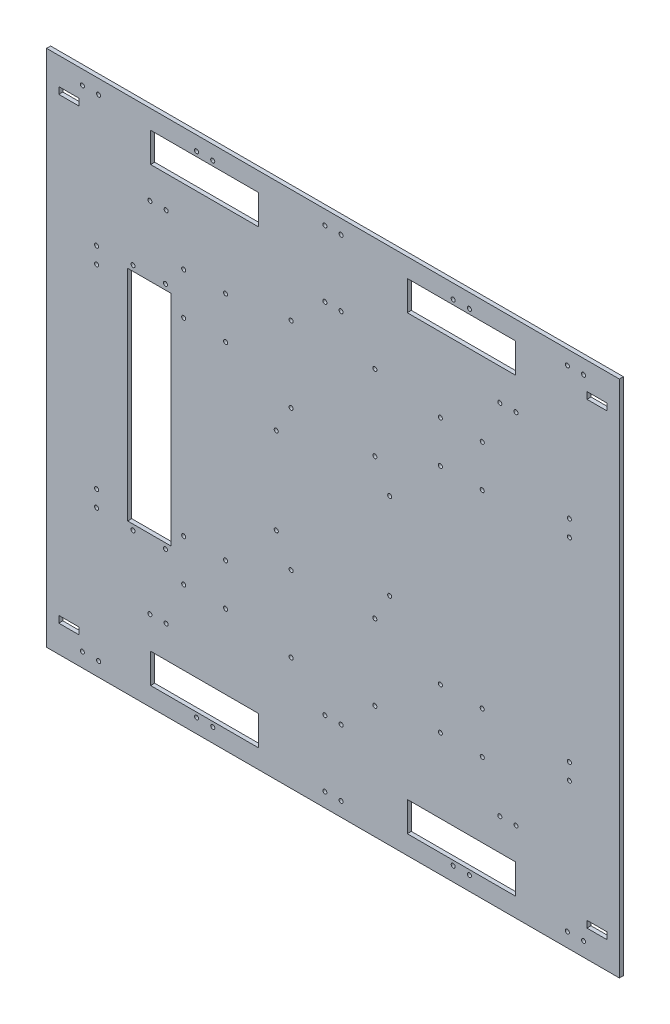
from build123d import *

# Parameters (mm, degrees)
SKETCH_1_W          = 424
SKETCH_1_H          = 384
SKETCH_1_W_2        = 80
SKETCH_1_H_2        = 22
EXTRUDE_1_DEPTH     = 3
SKETCH_2_R          = 1.5
SKETCH_2_W          = 32
SKETCH_2_H          = 162
CUT_EXTRUDE_1_DEPTH = 573.049823005
SKETCH_3_R          = 1.5
CUT_EXTRUDE_2_DEPTH = 573.049823005
SKETCH_4_R          = 1.5
CUT_EXTRUDE_3_DEPTH = 573.049823005
SKETCH_5_W          = 15
SKETCH_5_H          = 5
CUT_EXTRUDE_4_DEPTH = 573.049823005
SKETCH_6_R          = 1.5
CUT_EXTRUDE_5_DEPTH = 573.049823005


with BuildPart() as part:
    # 草图1 → 凸台-拉伸1 (new body)
    with BuildSketch(Plane.XY):
        with Locations((212, 192)):
            Rectangle(SKETCH_1_W, SKETCH_1_H)
        with Locations((307, 359)):
            Rectangle(SKETCH_1_W_2, SKETCH_1_H_2, mode=Mode.SUBTRACT)
        with Locations((117, 359)):
            Rectangle(SKETCH_1_W_2, SKETCH_1_H_2, mode=Mode.SUBTRACT)
        with Locations((307, 25)):
            Rectangle(SKETCH_1_W_2, SKETCH_1_H_2, mode=Mode.SUBTRACT)
        with Locations((117, 25)):
            Rectangle(SKETCH_1_W_2, SKETCH_1_H_2, mode=Mode.SUBTRACT)
    extrude(amount=EXTRUDE_1_DEPTH)

    # 草图2 → 切除-拉伸1 (cut, through all)
    with BuildSketch(Plane.XY.offset(3)):
        with Locations((64, 277)):
            Circle(SKETCH_2_R)
        with Locations((88, 277)):
            Circle(SKETCH_2_R)
        with Locations(Location((88, 107, 0), (0, 0, 180))):
            Circle(SKETCH_2_R)
        with Locations(Location((64, 107, 0), (0, 0, 180))):
            Circle(SKETCH_2_R)
        with Locations((76, 192)):
            Rectangle(SKETCH_2_W, SKETCH_2_H)
    extrude(amount=-CUT_EXTRUDE_1_DEPTH, mode=Mode.SUBTRACT)

    # 草图3 → 切除-拉伸2 (cut, through all)
    with BuildSketch(Plane.XY.offset(3)):
        with Locations((101.5, 293)):
            Circle(SKETCH_3_R)
        with Locations((132.5, 293)):
            Circle(SKETCH_3_R)
        with Locations((101.5, 262)):
            Circle(SKETCH_3_R)
        with Locations((132.5, 262)):
            Circle(SKETCH_3_R)
        with Locations(Location((322.5, 262, 0), (0, 0, 180))):
            Circle(SKETCH_3_R)
        with Locations(Location((291.5, 262, 0), (0, 0, 180))):
            Circle(SKETCH_3_R)
        with Locations(Location((291.5, 293, 0), (0, 0, 180))):
            Circle(SKETCH_3_R)
        with Locations(Location((322.5, 293, 0), (0, 0, 180))):
            Circle(SKETCH_3_R)
        with Locations((291.5, 122)):
            Circle(SKETCH_3_R)
        with Locations((322.5, 122)):
            Circle(SKETCH_3_R)
        with Locations((322.5, 91)):
            Circle(SKETCH_3_R)
        with Locations((291.5, 91)):
            Circle(SKETCH_3_R)
        with Locations(Location((101.5, 122, 0), (0, 0, 180))):
            Circle(SKETCH_3_R)
        with Locations(Location((132.5, 122, 0), (0, 0, 180))):
            Circle(SKETCH_3_R)
        with Locations(Location((132.5, 91, 0), (0, 0, 180))):
            Circle(SKETCH_3_R)
        with Locations(Location((101.5, 91, 0), (0, 0, 180))):
            Circle(SKETCH_3_R)
    extrude(amount=-CUT_EXTRUDE_2_DEPTH, mode=Mode.SUBTRACT)

    # 草图4 → 切除-拉伸3 (cut, through all)
    with BuildSketch(Plane.XY.offset(3)):
        with Locations((218, 10.5)):
            Circle(SKETCH_4_R)
        with Locations((301, 10.5)):
            Circle(SKETCH_4_R)
        with Locations((313, 10.5)):
            Circle(SKETCH_4_R)
        with Locations((385.5, 10.5)):
            Circle(SKETCH_4_R)
        with Locations((397.5, 10.5)):
            Circle(SKETCH_4_R)
        with Locations((218, 59.5)):
            Circle(SKETCH_4_R)
        with Locations((335.5, 59.5)):
            Circle(SKETCH_4_R)
        with Locations((347.5, 59.5)):
            Circle(SKETCH_4_R)
        with Locations((387, 108)):
            Circle(SKETCH_4_R)
        with Locations((387, 120)):
            Circle(SKETCH_4_R)
        with Locations(Location((387, 276, 0), (0, 0, 180))):
            Circle(SKETCH_4_R)
        with Locations(Location((387, 264, 0), (0, 0, 180))):
            Circle(SKETCH_4_R)
        with Locations(Location((301, 373.5, 0), (0, 0, 180))):
            Circle(SKETCH_4_R)
        with Locations(Location((313, 373.5, 0), (0, 0, 180))):
            Circle(SKETCH_4_R)
        with Locations(Location((397.5, 373.5, 0), (0, 0, 180))):
            Circle(SKETCH_4_R)
        with Locations(Location((385.5, 373.5, 0), (0, 0, 180))):
            Circle(SKETCH_4_R)
        with Locations(Location((347.5, 324.5, 0), (0, 0, 180))):
            Circle(SKETCH_4_R)
        with Locations(Location((335.5, 324.5, 0), (0, 0, 180))):
            Circle(SKETCH_4_R)
        with Locations(Location((218, 373.5, 0), (0, 0, 180))):
            Circle(SKETCH_4_R)
        with Locations(Location((206, 59.5, 0), (0, 0, 180))):
            Circle(SKETCH_4_R)
        with Locations(Location((206, 10.5, 0), (0, 0, 180))):
            Circle(SKETCH_4_R)
        with Locations(Location((111, 10.5, 0), (0, 0, 180))):
            Circle(SKETCH_4_R)
        with Locations(Location((123, 10.5, 0), (0, 0, 180))):
            Circle(SKETCH_4_R)
        with Locations(Location((26.5, 10.5, 0), (0, 0, 180))):
            Circle(SKETCH_4_R)
        with Locations(Location((38.5, 10.5, 0), (0, 0, 180))):
            Circle(SKETCH_4_R)
        with Locations(Location((76.5, 59.5, 0), (0, 0, 180))):
            Circle(SKETCH_4_R)
        with Locations(Location((88.5, 59.5, 0), (0, 0, 180))):
            Circle(SKETCH_4_R)
        with Locations(Location((37, 108, 0), (0, 0, 180))):
            Circle(SKETCH_4_R)
        with Locations(Location((37, 120, 0), (0, 0, 180))):
            Circle(SKETCH_4_R)
        with Locations((37, 264)):
            Circle(SKETCH_4_R)
        with Locations((37, 276)):
            Circle(SKETCH_4_R)
        with Locations((26.5, 373.5)):
            Circle(SKETCH_4_R)
        with Locations((38.5, 373.5)):
            Circle(SKETCH_4_R)
        with Locations((76.5, 324.5)):
            Circle(SKETCH_4_R)
        with Locations((88.5, 324.5)):
            Circle(SKETCH_4_R)
        with Locations((111, 373.5)):
            Circle(SKETCH_4_R)
        with Locations((123, 373.5)):
            Circle(SKETCH_4_R)
        with Locations((206, 373.5)):
            Circle(SKETCH_4_R)
        with Locations((206, 324.5)):
            Circle(SKETCH_4_R)
        with Locations(Location((218, 324.5, 0), (0, 0, 180))):
            Circle(SKETCH_4_R)
    extrude(amount=-CUT_EXTRUDE_3_DEPTH, mode=Mode.SUBTRACT)

    # 草图5 → 切除-拉伸4 (cut, through all)
    with BuildSketch(Plane.XY.offset(3)):
        with Locations((16.5, 361.5)):
            Rectangle(SKETCH_5_W, SKETCH_5_H)
        with Locations((407.5, 361.5)):
            Rectangle(SKETCH_5_W, SKETCH_5_H)
        with Locations((407.5, 22.5)):
            Rectangle(SKETCH_5_W, SKETCH_5_H)
        with Locations((16.5, 22.5)):
            Rectangle(SKETCH_5_W, SKETCH_5_H)
    extrude(amount=-CUT_EXTRUDE_4_DEPTH, mode=Mode.SUBTRACT)

    # 草图6 → 切除-拉伸5 (cut, through all)
    with BuildSketch(Plane.XY.offset(3)):
        with Locations((170, 224)):
            Circle(SKETCH_6_R)
        with Locations((170, 160)):
            Circle(SKETCH_6_R)
        with Locations((254, 160)):
            Circle(SKETCH_6_R)
        with Locations((254, 224)):
            Circle(SKETCH_6_R)
        with Locations((181, 300)):
            Circle(SKETCH_6_R)
        with Locations((243, 300)):
            Circle(SKETCH_6_R)
        with Locations((243, 244)):
            Circle(SKETCH_6_R)
        with Locations((181, 244)):
            Circle(SKETCH_6_R)
        with Locations(Location((181, 140, 0), (0, 0, 180))):
            Circle(SKETCH_6_R)
        with Locations(Location((243, 140, 0), (0, 0, 180))):
            Circle(SKETCH_6_R)
        with Locations(Location((243, 84, 0), (0, 0, 180))):
            Circle(SKETCH_6_R)
        with Locations(Location((181, 84, 0), (0, 0, 180))):
            Circle(SKETCH_6_R)
    extrude(amount=-CUT_EXTRUDE_5_DEPTH, mode=Mode.SUBTRACT)


solid = part.part
